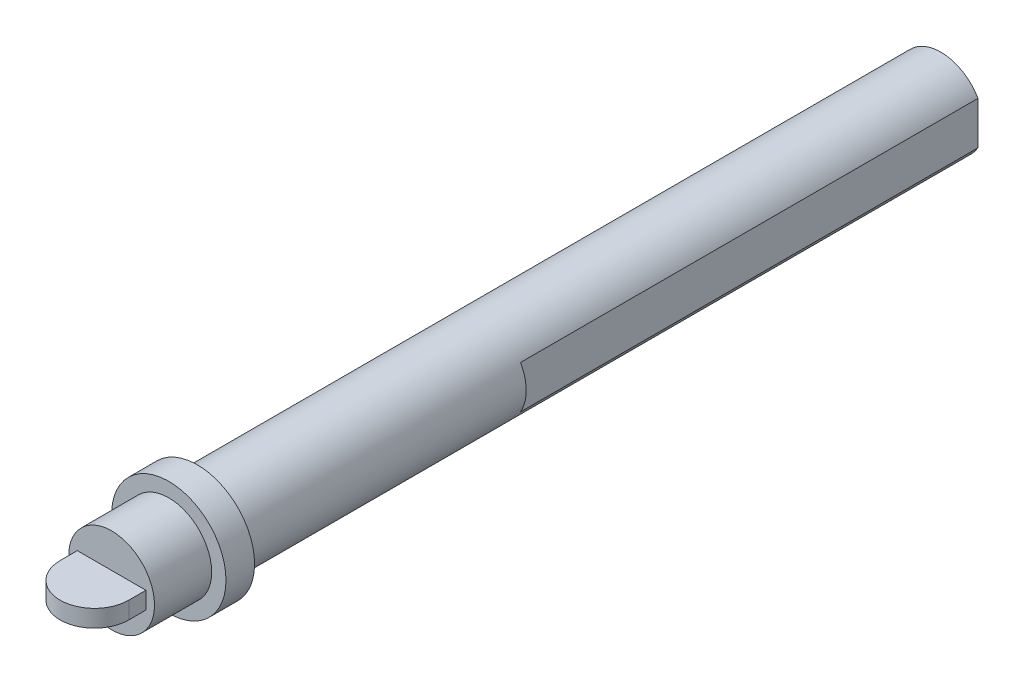
from build123d import *

# Parameters (mm, degrees)
SKETCH1_R                = 10
BOSS_EXTRUDE1_DEPTH      = 5
BOSS_EXTRUDE2_DEPTH      = 10
BOSS_EXTRUDE2_DEPTH_BACK = 135
SKETCH2_R                = 7.5
SKETCH3_W                = 12
SKETCH3_H                = 3
BOSS_EXTRUDE3_DEPTH      = 9
FILLET1_RADIUS           = 6
FILLET1_LENGTH           = 3
SKETCH4_W                = 1.891701955
SKETCH4_H                = 17.884356063
SKETCH4_W_2              = 1.598114715
SKETCH4_H_2              = 20.233053985
CUT_EXTRUDE1_DEPTH       = 80


with BuildPart() as part:
    # Sketch1 → Boss-Extrude1 (new body)
    with BuildSketch(Plane.XY):
        Circle(SKETCH1_R)
    extrude(amount=BOSS_EXTRUDE1_DEPTH)

    # Sketch2 → Boss-Extrude2 (add, two sides: drawn at the far end of the back side and taken through both)
    with BuildSketch(Plane.XY.offset(5).offset(-BOSS_EXTRUDE2_DEPTH_BACK)):
        Circle(SKETCH2_R)
    extrude(amount=BOSS_EXTRUDE2_DEPTH + BOSS_EXTRUDE2_DEPTH_BACK)

    # Sketch3 → Boss-Extrude3 (add)
    with BuildSketch(Plane.XY.offset(15)):
        Rectangle(SKETCH3_W, SKETCH3_H)
    extrude(amount=BOSS_EXTRUDE3_DEPTH)

    # Fillet1: full round fillet: the end face becomes a half cylinder, R = half its width
    fillet1_face = Plane((0, 0, 24), x_dir=(0, -1, 0), z_dir=(0, 0, 1))  # on the end face: x along it, z out of the body
    fillet1_slab = fillet1_face.offset(-FILLET1_RADIUS / 2) * Box(FILLET1_LENGTH, 2 * FILLET1_RADIUS, FILLET1_RADIUS, mode=Mode.PRIVATE)  # the body's end, R deep
    fillet1_round = Plane((0, 0, 18), x_dir=(0, 0, 1), z_dir=(0, -1, 0)) * Cylinder(FILLET1_RADIUS, FILLET1_LENGTH, mode=Mode.PRIVATE)  # its axis R under the face
    add(fillet1_slab - fillet1_round, mode=Mode.SUBTRACT)

    # Sketch4 → Cut-Extrude1 (cut)
    with BuildSketch(Plane(origin=(0, 0, -130), x_dir=(-1, 0, 0), z_dir=(0, 0, -1))):
        with Locations((-7.445850978, -1.957248269)):
            Rectangle(SKETCH4_W, SKETCH4_H)
        with Locations((7.299057358, -1.296676979)):
            Rectangle(SKETCH4_W_2, SKETCH4_H_2)
    extrude(amount=-CUT_EXTRUDE1_DEPTH, mode=Mode.SUBTRACT)


solid = part.part
